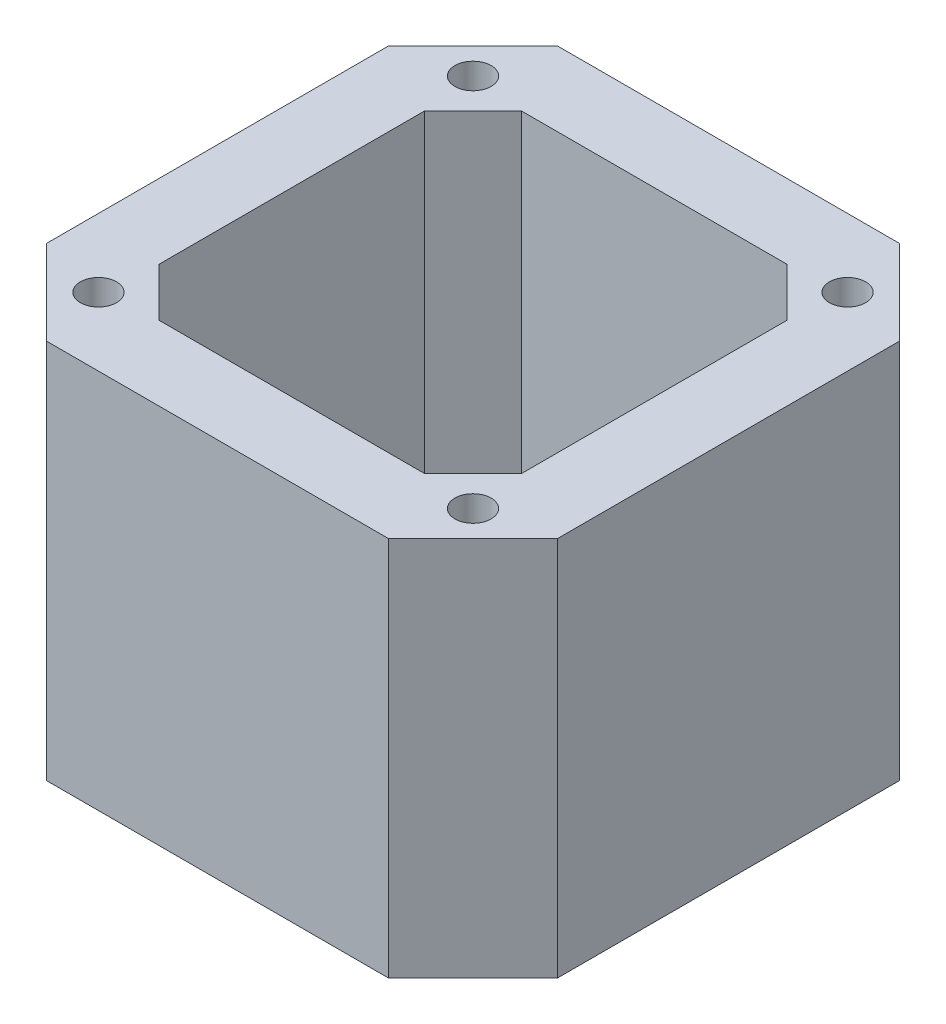
from build123d import *

# Parameters (mm, degrees)
BOSS_EXTRUDE1_DEPTH = 31.5
SKETCH2_R           = 1.5
CUT_EXTRUDE1_DEPTH  = 5
CUT_EXTRUDE3_DEPTH  = 45


with BuildPart() as part:
    # Sketch1 → Boss-Extrude1 (new body)
    with BuildSketch(Plane(origin=(0, 0, 0), x_dir=(1, 0, 0), z_dir=(0, 1, 0))):
        Polygon((-21.15, 14.15), (-14.15, 21.15), (14.15, 21.15), (21.15, 14.15), (21.15, -14.15), (14.15, -21.15), (-14.15, -21.15), (-21.15, -14.15), align=None)
    extrude(amount=BOSS_EXTRUDE1_DEPTH)

    # Sketch2 → Cut-Extrude1 (cut)
    with BuildSketch(Plane(origin=(0, 31.5, 0), x_dir=(1, 0, 0), z_dir=(0, 1, 0))):
        with Locations(Location((-15.5, 15.5, 0), (0, 0, 270))):
            Circle(SKETCH2_R)
        with Locations(Location((15.5, 15.5, 0), (0, 0, 270))):
            Circle(SKETCH2_R)
        with Locations(Location((-15.5, -15.5, 0), (0, 0, 270))):
            Circle(SKETCH2_R)
        with Locations(Location((15.5, -15.5, 0), (0, 0, 270))):
            Circle(SKETCH2_R)
    extrude(amount=-CUT_EXTRUDE1_DEPTH, mode=Mode.SUBTRACT)

    # Sketch3 → Cut-Extrude3 (cut)
    with BuildSketch(Plane(origin=(0, 31.5, 0), x_dir=(1, 0, 0), z_dir=(0, 1, 0))):
        Polygon((-15, 11), (-11, 15), (11, 15), (15, 11), (15, -11), (11, -15), (-11, -15), (-15, -11), align=None)
    extrude(amount=-CUT_EXTRUDE3_DEPTH, mode=Mode.SUBTRACT)


solid = part.part
